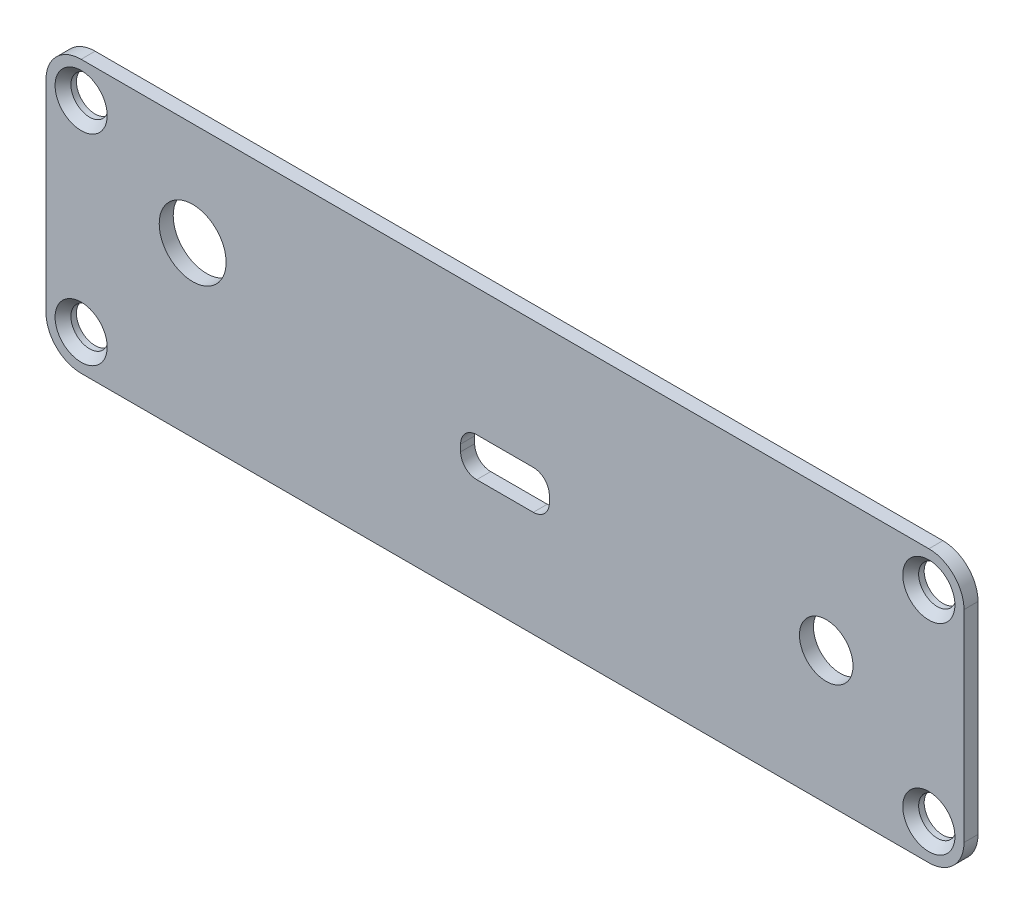
from build123d import *

# Parameters (mm, degrees)
SKETCH1_W                                     = 102.87
SKETCH1_H                                     = 30.48
BOSS_EXTRUDE1_DEPTH                           = 1.57
FILLET1_R                                     = 3.935
CSK_FOR_6_FLAT_HEAD_MACHINE_SCREW1_AT_2_COUNT = 2
CSK_FOR_6_FLAT_HEAD_MACHINE_SCREW1_AT_2_PITCH = 22.479
CSK_FOR_6_FLAT_HEAD_MACHINE_SCREW1_AT_3_COUNT = 2
CSK_FOR_6_FLAT_HEAD_MACHINE_SCREW1_AT_3_PITCH = 94.996
CSK_FOR_6_FLAT_HEAD_MACHINE_SCREW1_AT_4_COUNT = 2
CSK_FOR_6_FLAT_HEAD_MACHINE_SCREW1_AT_4_PITCH = 97.619390784
DATA_SIDE_R                                   = 3.25
DATA_SIDE_R_2                                 = 2.5
CUT_EXTRUDE9_DEPTH                            = 1.57
MOVE_FACE4_BY                                 = 0.5
MOVE_FACE4_2_BY                               = 0.5
MOVE_FACE4_3_BY                               = 0.5
MOVE_FACE4_4_BY                               = 0.5
MOVE_FACE4_5_BY                               = 0.5
MOVE_FACE4_6_BY                               = 0.5
MOVE_FACE4_7_BY                               = 0.5
MOVE_FACE4_8_BY                               = 0.5
MOVE_FACE4_9_BY                               = 0.5
MOVE_FACE4_10_BY                              = 0.5


with BuildPart() as part:
    # Sketch1 → Boss-Extrude1 (new body)
    with BuildSketch(Plane.XY):
        with Locations((51.435, 15.24)):
            Rectangle(SKETCH1_W, SKETCH1_H)
    extrude(amount=BOSS_EXTRUDE1_DEPTH)

    # Fillet1
    fillet1_edges = [part.edges().sort_by_distance(p)[0] for p in [
        (0, 30.48, 0.785),
        (102.87, 30.48, 0.785),
        (102.87, 0, 0.785),
        (0, 0, 0.785),
    ]]
    fillet(fillet1_edges, radius=FILLET1_R)

    # Sketch4 → CSK for #6 Flat Head Machine Screw1 (revolve, cut)
    with BuildSketch(Plane(origin=(3.937, 26.4795, 1.57), x_dir=(0, -1, 0), z_dir=(1, 0, 0))):
        Polygon((0, 0), (0, 1.57), (2.0955, 1.57), (2.0955, 0.94962912), (2.921, 0), align=None)
    csk_for_6_flat_head_machine_screw1 = revolve(axis=Axis((3.937, 26.4795, 7.92), (0, 0, -1)), mode=Mode.SUBTRACT)

    # CSK for #6 Flat Head Machine Screw1 at 2: CSK for #6 Flat Head Machine Screw1 ×2
    with Locations(*[(0, -i * CSK_FOR_6_FLAT_HEAD_MACHINE_SCREW1_AT_2_PITCH, 0) for i in range(1, CSK_FOR_6_FLAT_HEAD_MACHINE_SCREW1_AT_2_COUNT)]):
        add(csk_for_6_flat_head_machine_screw1, mode=Mode.SUBTRACT)

    # CSK for #6 Flat Head Machine Screw1 at 3: CSK for #6 Flat Head Machine Screw1 ×2
    with Locations(*[(i * CSK_FOR_6_FLAT_HEAD_MACHINE_SCREW1_AT_3_PITCH, 0, 0) for i in range(1, CSK_FOR_6_FLAT_HEAD_MACHINE_SCREW1_AT_3_COUNT)]):
        add(csk_for_6_flat_head_machine_screw1, mode=Mode.SUBTRACT)

    # CSK for #6 Flat Head Machine Screw1 at 4: CSK for #6 Flat Head Machine Screw1 ×2
    with Locations(*[Vector(0.9731263352215668, -0.23027187344146696, 0) * (i * CSK_FOR_6_FLAT_HEAD_MACHINE_SCREW1_AT_4_PITCH) for i in range(1, CSK_FOR_6_FLAT_HEAD_MACHINE_SCREW1_AT_4_COUNT)]):
        add(csk_for_6_flat_head_machine_screw1, mode=Mode.SUBTRACT)

    # data side → Cut-Extrude9 (cut)
    with BuildSketch(Plane.XY):
        with Locations(Location((16.435, 18.8995, 0), (0, 0, 180))):
            Circle(DATA_SIDE_R)
        with Locations(Location((87.435, 14.8495, 0), (0, 0, 180))):
            Circle(DATA_SIDE_R_2)
        with BuildLine():
            Line((48.265, 15.7095), (54.605, 15.7095))
            ThreePointArc((54.605, 15.7095), (55.524238816, 15.328738816), (55.905, 14.4095))
            Line((55.905, 14.4095), (55.905, 13.6495))
            ThreePointArc((55.905, 13.6495), (55.524238816, 12.730261184), (54.605, 12.3495))
            Line((54.605, 12.3495), (48.265, 12.3495))
            ThreePointArc((48.265, 12.3495), (47.345761184, 12.730261184), (46.965, 13.6495))
            Line((46.965, 13.6495), (46.965, 14.4095))
            ThreePointArc((46.965, 14.4095), (47.345761184, 15.328738816), (48.265, 15.7095))
        make_face()
    extrude(amount=CUT_EXTRUDE9_DEPTH, mode=Mode.SUBTRACT)

    # Move Face4: a curved face moved inward by 0.5
    add(Solid.thicken(part.faces().sort_by_distance((89.935, 14.8495, 0.785))[0], -MOVE_FACE4_BY), mode=Mode.SUBTRACT)

    # Move Face4 2: a curved face moved inward by 0.5
    add(Solid.thicken(part.faces().sort_by_distance((19.685, 18.8995, 0.785))[0], -MOVE_FACE4_2_BY), mode=Mode.SUBTRACT)

    # Move Face4 3: a curved face moved inward by 0.5
    add(Solid.thicken(part.faces().sort_by_distance((55.524238816, 12.730261184, 0.785))[0], -MOVE_FACE4_3_BY), mode=Mode.SUBTRACT)

    # Move Face4 4: a curved face moved inward by 0.5
    add(Solid.thicken(part.faces().sort_by_distance((55.524238816, 15.328738816, 0.785))[0], -MOVE_FACE4_4_BY), mode=Mode.SUBTRACT)

    # Move Face4 5: a face moved inward by 0.5
    extrude(part.faces().sort_by_distance((55.905, 14.0295, 0.785))[0], amount=MOVE_FACE4_5_BY, dir=(1, 0, 0), mode=Mode.SUBTRACT)

    # Move Face4 6: a face moved inward by 0.5
    extrude(part.faces().sort_by_distance((51.435, 12.3495, 0.785))[0], amount=MOVE_FACE4_6_BY, dir=(0, -1, 0), mode=Mode.SUBTRACT)

    # Move Face4 7: a curved face moved inward by 0.5
    add(Solid.thicken(part.faces().sort_by_distance((47.345761184, 12.730261184, 0.785))[0], -MOVE_FACE4_7_BY), mode=Mode.SUBTRACT)

    # Move Face4 8: a face moved inward by 0.5
    extrude(part.faces().sort_by_distance((46.965, 14.0295, 0.785))[0], amount=MOVE_FACE4_8_BY, dir=(-1, 0, 0), mode=Mode.SUBTRACT)

    # Move Face4 9: a face moved inward by 0.5
    extrude(part.faces().sort_by_distance((51.435, 15.7095, 0.785))[0], amount=MOVE_FACE4_9_BY, dir=(0, 1, 0), mode=Mode.SUBTRACT)

    # Move Face4 10: a curved face moved inward by 0.5
    add(Solid.thicken(part.faces().sort_by_distance((47.345761184, 15.328738816, 0.785))[0], -MOVE_FACE4_10_BY), mode=Mode.SUBTRACT)


solid = part.part
